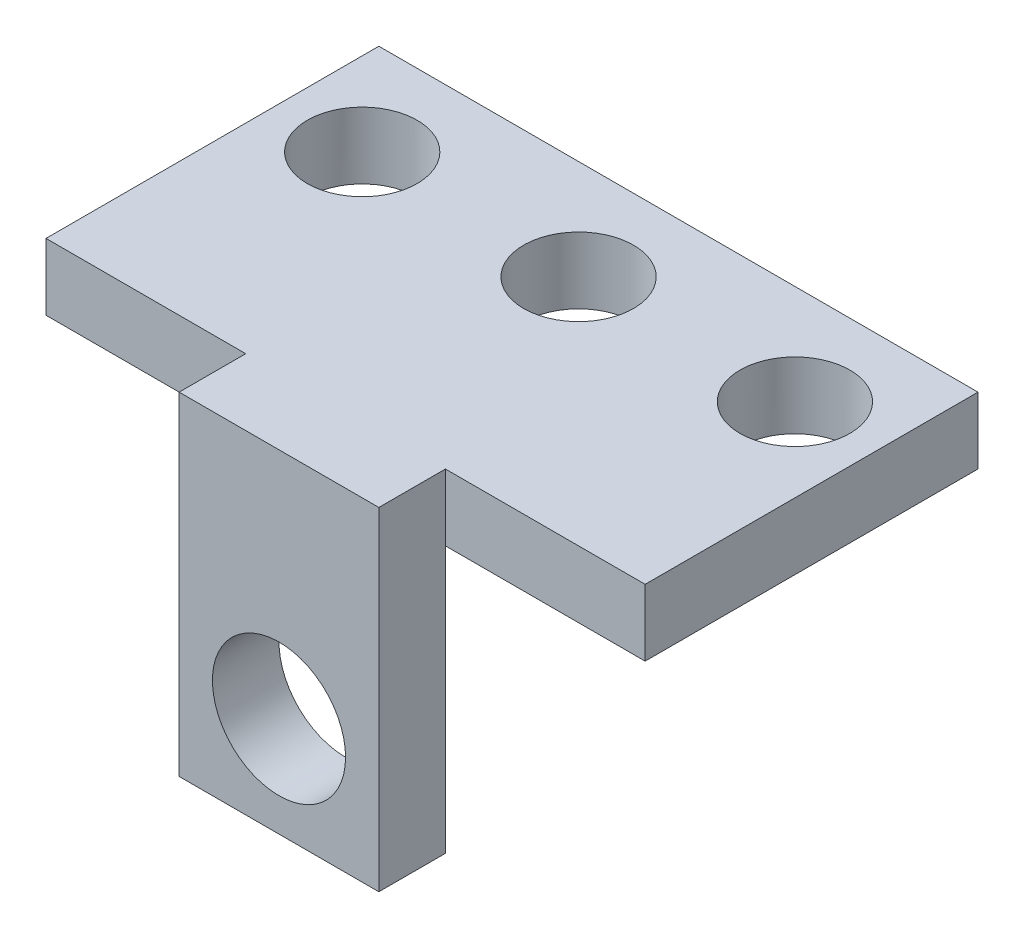
from build123d import *

# Parameters (mm, degrees)
SKETCH_1_W          = 6
SKETCH_1_H          = 8
SKETCH_1_R          = 2
EXTRUDE_1_DEPTH     = 2
SKETCH_2_W          = 6
SKETCH_2_H          = 12
SKETCH_2_R          = 1.65
EXTRUDE_2_DEPTH     = 2
SKETCH_3_W          = 10
SKETCH_3_H          = 2
EXTRUDE_3_DEPTH     = 6
SKETCH_4_W          = 10
SKETCH_4_H          = 2
EXTRUDE_4_DEPTH     = 6
SKETCH_6_R          = 1.65
CUT_EXTRUDE_1_DEPTH = 6


with BuildPart() as part:
    # 草图1 → 凸台-拉伸1 (new body)
    with BuildSketch(Plane.XY):
        with Locations((0, 1)):
            Rectangle(SKETCH_1_W, SKETCH_1_H)
        Circle(SKETCH_1_R, mode=Mode.SUBTRACT)
    extrude(amount=EXTRUDE_1_DEPTH)

    # 草图2 → 凸台-拉伸2 (add)
    with BuildSketch(Plane(origin=(0, 5, 0), x_dir=(1, 0, 0), z_dir=(0, 1, 0))):
        with Locations((0, 4)):
            Rectangle(SKETCH_2_W, SKETCH_2_H)
        with Locations(Location((0, 7, 0), (0, 0, 270))):
            Circle(SKETCH_2_R, mode=Mode.SUBTRACT)
    extrude(amount=EXTRUDE_2_DEPTH)

    # 草图3 → 凸台-拉伸3 (add)
    with BuildSketch(Plane.ZY.offset(3)):
        with Locations((-5, 6)):
            Rectangle(SKETCH_3_W, SKETCH_3_H)
    extrude(amount=EXTRUDE_3_DEPTH)

    # 草图4 → 凸台-拉伸4 (add)
    with BuildSketch(Plane(origin=(3, 0, 0), x_dir=(0, 0, -1), z_dir=(1, 0, 0))):
        with Locations((5, 6)):
            Rectangle(SKETCH_4_W, SKETCH_4_H)
    extrude(amount=EXTRUDE_4_DEPTH)

    # 草图6 → 切除-拉伸1 (cut)
    with BuildSketch(Plane(origin=(0, 7, 0), x_dir=(1, 0, 0), z_dir=(0, 1, 0))):
        with Locations(Location((-6.5, 7, 0), (0, 0, 270))):
            Circle(SKETCH_6_R)
        with Locations(Location((6.5, 7, 0), (0, 0, 270))):
            Circle(SKETCH_6_R)
    extrude(amount=-CUT_EXTRUDE_1_DEPTH, mode=Mode.SUBTRACT)


solid = part.part
